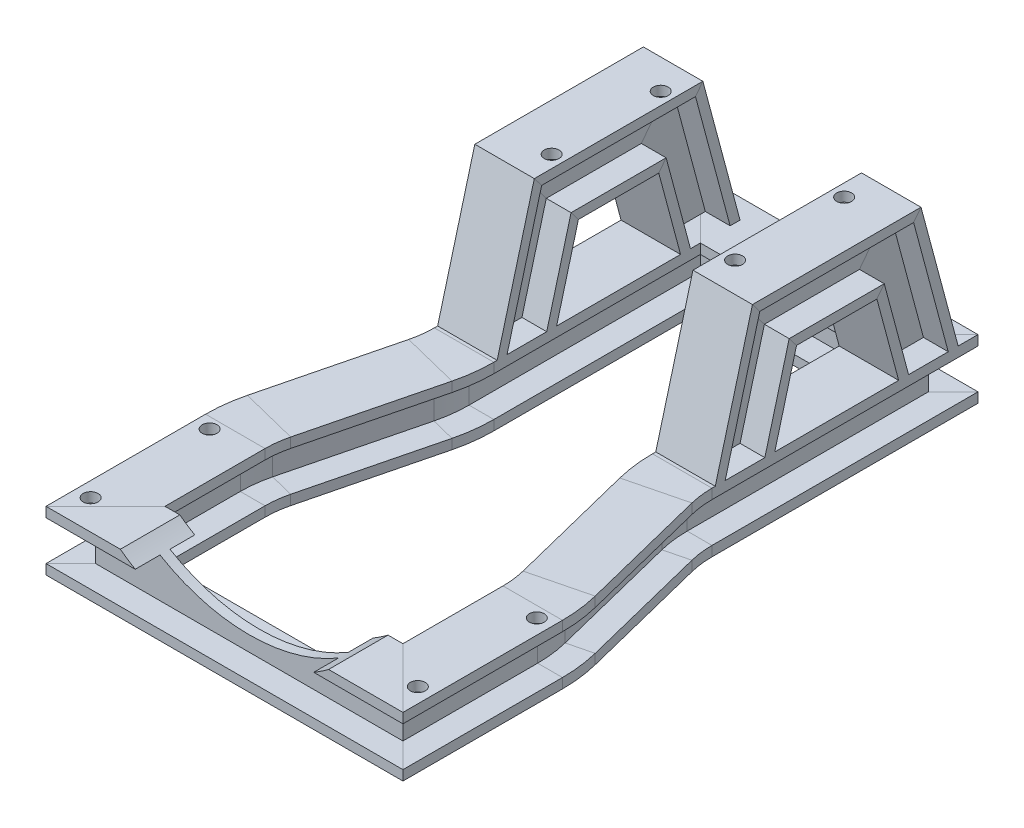
from build123d import *

# Parameters (mm, degrees)
CUT_EXTRUDE1_START   = -1
CUT_EXTRUDE1_DEPTH   = 5
MIRROR2_START        = -1
MIRROR2_COPY_1_DEPTH = 5
CUT_EXTRUDE2_REACH   = 84.098
SKETCH6_R            = 1.5
CUT_EXTRUDE3_REACH   = 78.968
SKETCH7_R            = 1.5
SKETCH8_R            = 35.200319601
CUT_EXTRUDE4_DEPTH   = 12


with BuildPart() as part:
    # Sweep1: sweep along a path in Sketch1
    with BuildLine(Plane(origin=(0, 0, 0), x_dir=(1, 0, 0), z_dir=(0, 1, 0))) as sweep1_path:
        Line((-28, 62), (28, 62))
        Line((28, 62), (28, 8.339006887))
        ThreePointArc((28, 8.339006887), (28.142356423, 6.017524877), (28.567292497, 3.730830011))
        Line((28.567292497, 3.730830011), (35.074417505, -22.297670018))
        ThreePointArc((35.074417505, -22.297670018), (35.767734257, -26.02859322), (36, -29.816274394))
        Line((36, -29.816274394), (36, -62))
        Line((36, -62), (-36, -62))
        Line((-36, -62), (-36, -29.816274394))
        ThreePointArc((-36, -29.816274394), (-35.767734257, -26.02859322), (-35.074417505, -22.297670018))
        Line((-35.074417505, -22.297670018), (-28.567292497, 3.730830011))
        ThreePointArc((-28.567292497, 3.730830011), (-28.142356423, 6.017524877), (-28, 8.339006887))
        Line((-28, 8.339006887), (-28, 62))
    # Sketch2 → Sweep1 (sweep)
    with BuildSketch(Plane.XY.offset(-62)):
        Polygon((28, 0), (16, 0), (16, 2), (21, 2), (21, 10), (16, 10), (16, 12), (28, 12), (28, 10), (23, 10), (23, 2), (28, 2), align=None)
    sweep(path=sweep1_path.line, transition=Transition.RIGHT)

    # Sweep2: sweep along a path in Sketch3
    with BuildLine(Plane(origin=(28, 0, 0), x_dir=(0, 0, -1), z_dir=(1, 0, 0))) as sweep2_path:
        Line((9, 12), (16.5, 40))
        Line((16.5, 40), (50.5, 40))
        Line((50.5, 40), (58, 12))
    # Sketch4 → Sweep2 (sweep)
    with BuildSketch(Plane(origin=(0, 12, 0), x_dir=(1, 0, 0), z_dir=(0, 1, 0))):
        Polygon((28, 58), (16, 58), (16, 56), (21, 56), (21, 48), (16, 48), (16, 46), (28, 46), (28, 48), (23, 48), (23, 56), (28, 56), align=None)
    sweep2 = sweep(path=sweep2_path.line, transition=Transition.RIGHT)

    # Sketch5 → Cut-Extrude1 (cut)
    with BuildSketch(Plane(origin=(22, 0, 0), x_dir=(0, 0, -1), z_dir=(1, 0, 0)).offset(CUT_EXTRUDE1_START)):
        Polygon((17.661112764, 7.001487652), (18.464285714, 10), (20.464285714, 10), (19.393335317, 6.001785183), align=None)
    cut_extrude1 = extrude(amount=-CUT_EXTRUDE1_DEPTH, mode=Mode.SUBTRACT)

    # Mirror1: Cut-Extrude1 across plane
    add(cut_extrude1.mirror(Plane(origin=(22, 0, 0), x_dir=(0, 0, 1), z_dir=(1, 0, 0))), mode=Mode.SUBTRACT)

    # Mirror2: Sweep2, Cut-Extrude1 across plane
    add(sweep2.mirror(Plane(origin=(0, 0, 0), x_dir=(0, 0, 1), z_dir=(1, 0, 0))))
    add(cut_extrude1.mirror(Plane(origin=(0, 0, 0), x_dir=(0, 0, 1), z_dir=(1, 0, 0))), mode=Mode.SUBTRACT)

    # Mirror2 copy 1 sketch → Mirror2 copy 1 (cut)
    with BuildSketch(Plane(origin=(-22, 0, 0), x_dir=(0, 0, -1), z_dir=(1, 0, 0)).offset(MIRROR2_START)):
        Polygon((17.661112764, 7.001487652), (18.464285714, 10), (20.464285714, 10), (19.393335317, 6.001785183), align=None)
    extrude(amount=-MIRROR2_COPY_1_DEPTH, mode=Mode.SUBTRACT)

    # Sketch6 → Cut-Extrude2 (cut, up to next)
    with BuildSketch(Plane(origin=(0, 40, 0), x_dir=(1, 0, 0), z_dir=(0, 1, 0)), mode=Mode.PRIVATE) as cut_extrude2_sk1:
        with Locations(Location((18.5, 44.5, 0), (0, 0, 180))):
            Circle(SKETCH6_R)
    cut_extrude2_tool1 = extrude(cut_extrude2_sk1.sketch, amount=-CUT_EXTRUDE2_REACH, mode=Mode.PRIVATE) & part.part
    # Sketch6 → Cut-Extrude2 (cut, up to next)
    with BuildSketch(Plane(origin=(0, 40, 0), x_dir=(1, 0, 0), z_dir=(0, 1, 0)), mode=Mode.PRIVATE) as cut_extrude2_sk2:
        with Locations(Location((18.5, 22.5, 0), (0, 0, 180))):
            Circle(SKETCH6_R)
    cut_extrude2_tool2 = extrude(cut_extrude2_sk2.sketch, amount=-CUT_EXTRUDE2_REACH, mode=Mode.PRIVATE) & part.part
    # Sketch6 → Cut-Extrude2 (cut, up to next)
    with BuildSketch(Plane(origin=(0, 40, 0), x_dir=(1, 0, 0), z_dir=(0, 1, 0)), mode=Mode.PRIVATE) as cut_extrude2_sk3:
        with Locations(Location((-18.5, 44.5, 0), (0, 0, 180))):
            Circle(SKETCH6_R)
    cut_extrude2_tool3 = extrude(cut_extrude2_sk3.sketch, amount=-CUT_EXTRUDE2_REACH, mode=Mode.PRIVATE) & part.part
    # Sketch6 → Cut-Extrude2 (cut, up to next)
    with BuildSketch(Plane(origin=(0, 40, 0), x_dir=(1, 0, 0), z_dir=(0, 1, 0)), mode=Mode.PRIVATE) as cut_extrude2_sk4:
        with Locations(Location((-18.5, 22.5, 0), (0, 0, 180))):
            Circle(SKETCH6_R)
    cut_extrude2_tool4 = extrude(cut_extrude2_sk4.sketch, amount=-CUT_EXTRUDE2_REACH, mode=Mode.PRIVATE) & part.part
    add(cut_extrude2_tool1.solids().sort_by_distance((18.5, 40, -44.5))[0], mode=Mode.SUBTRACT)
    add(cut_extrude2_tool2.solids().sort_by_distance((18.5, 40, -22.5))[0], mode=Mode.SUBTRACT)
    add(cut_extrude2_tool3.solids().sort_by_distance((-18.5, 40, -44.5))[0], mode=Mode.SUBTRACT)
    add(cut_extrude2_tool4.solids().sort_by_distance((-18.5, 40, -22.5))[0], mode=Mode.SUBTRACT)

    # Sketch7 → Cut-Extrude3 (cut, up to next)
    with BuildSketch(Plane(origin=(0, 12, 0), x_dir=(1, 0, 0), z_dir=(0, 1, 0)), mode=Mode.PRIVATE) as cut_extrude3_sk1:
        with Locations(Location((33, -32, 0), (0, 0, 270))):
            Circle(SKETCH7_R)
    cut_extrude3_tool1 = extrude(cut_extrude3_sk1.sketch, amount=-CUT_EXTRUDE3_REACH, mode=Mode.PRIVATE) & part.part
    # Sketch7 → Cut-Extrude3 (cut, up to next)
    with BuildSketch(Plane(origin=(0, 12, 0), x_dir=(1, 0, 0), z_dir=(0, 1, 0)), mode=Mode.PRIVATE) as cut_extrude3_sk2:
        with Locations(Location((33, -56, 0), (0, 0, 270))):
            Circle(SKETCH7_R)
    cut_extrude3_tool2 = extrude(cut_extrude3_sk2.sketch, amount=-CUT_EXTRUDE3_REACH, mode=Mode.PRIVATE) & part.part
    # Sketch7 → Cut-Extrude3 (cut, up to next)
    with BuildSketch(Plane(origin=(0, 12, 0), x_dir=(1, 0, 0), z_dir=(0, 1, 0)), mode=Mode.PRIVATE) as cut_extrude3_sk3:
        with Locations((-33, -56)):
            Circle(SKETCH7_R)
    cut_extrude3_tool3 = extrude(cut_extrude3_sk3.sketch, amount=-CUT_EXTRUDE3_REACH, mode=Mode.PRIVATE) & part.part
    # Sketch7 → Cut-Extrude3 (cut, up to next)
    with BuildSketch(Plane(origin=(0, 12, 0), x_dir=(1, 0, 0), z_dir=(0, 1, 0)), mode=Mode.PRIVATE) as cut_extrude3_sk4:
        with Locations((-33, -32)):
            Circle(SKETCH7_R)
    cut_extrude3_tool4 = extrude(cut_extrude3_sk4.sketch, amount=-CUT_EXTRUDE3_REACH, mode=Mode.PRIVATE) & part.part
    add(cut_extrude3_tool1.solids().sort_by_distance((33, 12, 32))[0], mode=Mode.SUBTRACT)
    add(cut_extrude3_tool2.solids().sort_by_distance((33, 12, 56))[0], mode=Mode.SUBTRACT)
    add(cut_extrude3_tool3.solids().sort_by_distance((-33, 12, 56))[0], mode=Mode.SUBTRACT)
    add(cut_extrude3_tool4.solids().sort_by_distance((-33, 12, 32))[0], mode=Mode.SUBTRACT)

    # Sketch8 → Cut-Extrude4 (cut)
    with BuildSketch(Plane.XY.offset(62)):
        with Locations((0, 40.25)):
            Circle(SKETCH8_R)
    extrude(amount=-CUT_EXTRUDE4_DEPTH, mode=Mode.SUBTRACT)


solid = part.part
